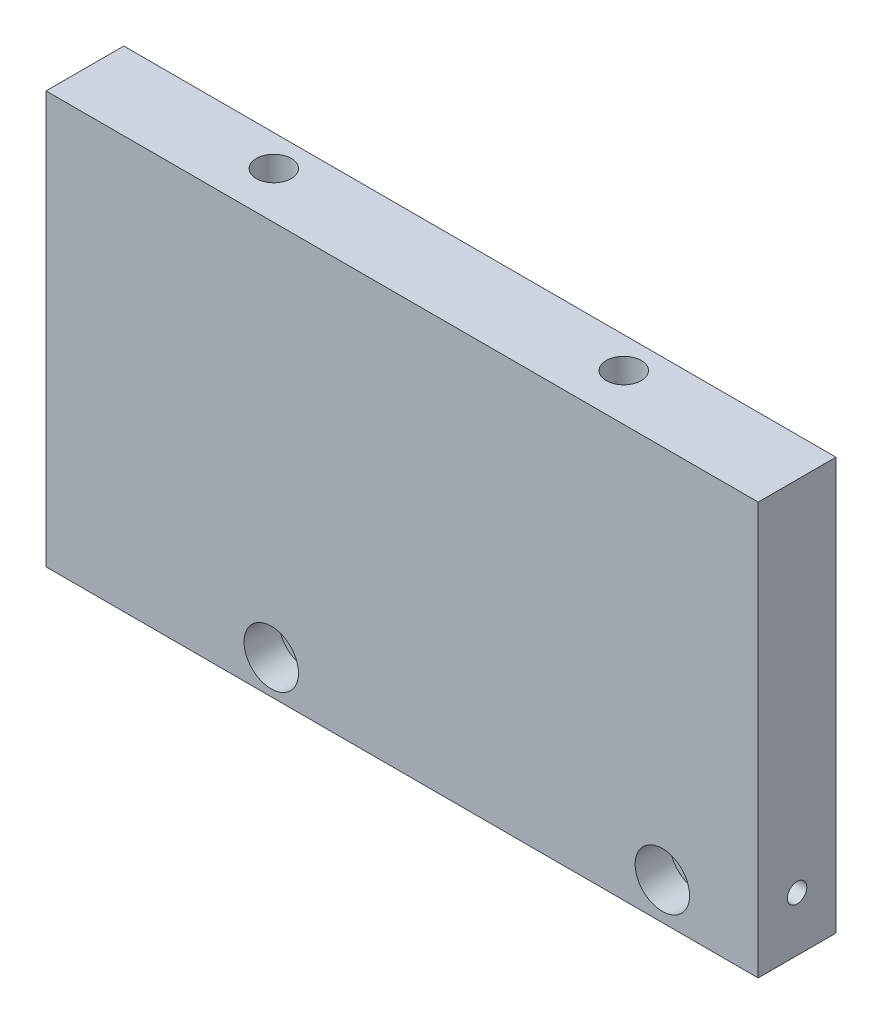
from build123d import *

# Parameters (mm, degrees)
SKETCH1_W           = 91.58
SKETCH1_H           = 10
BOSS_EXTRUDE1_DEPTH = 53
SKETCH2_R           = 1.75
CUT_EXTRUDE1_DEPTH  = 71.75114204
SKETCH4_W           = 15
SKETCH4_H           = 25
CUT_EXTRUDE3_DEPTH  = 8
SKETCH5_R           = 2.25
CUT_EXTRUDE4_DEPTH  = 17
SKETCH7_R           = 3.5
CUT_EXTRUDE5_DEPTH  = 4.5
FILLET1_R           = 2.5


with BuildPart() as part:
    # Sketch1 → Boss-Extrude1 (new body)
    with BuildSketch(Plane(origin=(0, 0, 0), x_dir=(1, 0, 0), z_dir=(0, 1, 0))):
        Rectangle(SKETCH1_W, SKETCH1_H)
    extrude(amount=BOSS_EXTRUDE1_DEPTH)

    # Sketch2 → Cut-Extrude1 (cut, through all)
    with BuildSketch(Plane.XY.offset(5)):
        with Locations((33.464, 4.763)):
            Circle(SKETCH2_R)
        with Locations((-16.828, 4.382)):
            Circle(SKETCH2_R)
    extrude(amount=-CUT_EXTRUDE1_DEPTH, mode=Mode.SUBTRACT)

    # Sketch4 → Cut-Extrude3 (cut)
    with BuildSketch(Plane(origin=(0, 0, -5), x_dir=(-1, 0, 0), z_dir=(0, 0, -1))):
        with Locations((22.5, 35.5)):
            Rectangle(SKETCH4_W, SKETCH4_H)
        with Locations((-22.5, 35.5)):
            Rectangle(SKETCH4_W, SKETCH4_H)
    extrude(amount=-CUT_EXTRUDE3_DEPTH, mode=Mode.SUBTRACT)

    # Sketch5 → Cut-Extrude4 (cut)
    with BuildSketch(Plane(origin=(0, 53, 0), x_dir=(1, 0, 0), z_dir=(0, 1, 0))):
        with Locations(Location((22.5, 1, 0), (0, 0, 270))):
            Circle(SKETCH5_R)
        with Locations(Location((-22.5, 1, 0), (0, 0, 270))):
            Circle(SKETCH5_R)
    extrude(amount=-CUT_EXTRUDE4_DEPTH, mode=Mode.SUBTRACT)

    # Sketch7 → Cut-Extrude5 (cut)
    with BuildSketch(Plane.XY.offset(5)):
        with Locations((33.464, 4.763)):
            Circle(SKETCH7_R)
        with Locations((-16.828, 4.382)):
            Circle(SKETCH7_R)
    extrude(amount=-CUT_EXTRUDE5_DEPTH, mode=Mode.SUBTRACT)

    # Sketch9 → M3 Tapped Hole1 (revolve, cut)
    with BuildSketch(Plane(origin=(-45.79, 7, 0), x_dir=(0, 0, 1), z_dir=(0, 1, 0))):
        Polygon((0, 0), (0, 8.251075774), (1.25, 7.5), (1.25, 0), align=None)
    m3_tapped_hole1 = revolve(axis=Axis((-52.14, 7, 0), (1, 0, 0)), mode=Mode.SUBTRACT)

    # Mirror1: M3 Tapped Hole1 across plane
    add(m3_tapped_hole1.mirror(Plane(origin=(0, 0, 0), x_dir=(0, 0, 1), z_dir=(1, 0, 0))), mode=Mode.SUBTRACT)

    # Fillet1
    fillet1_edges = [part.edges().sort_by_distance(p)[0] for p in [
        (-30, 48, -1),
        (-30, 23, -1),
        (-15, 23, -1),
        (-15, 48, -1),
        (15, 48, -1),
        (15, 23, -1),
        (30, 23, -1),
        (30, 48, -1),
    ]]
    fillet(fillet1_edges, radius=FILLET1_R)


solid = part.part
